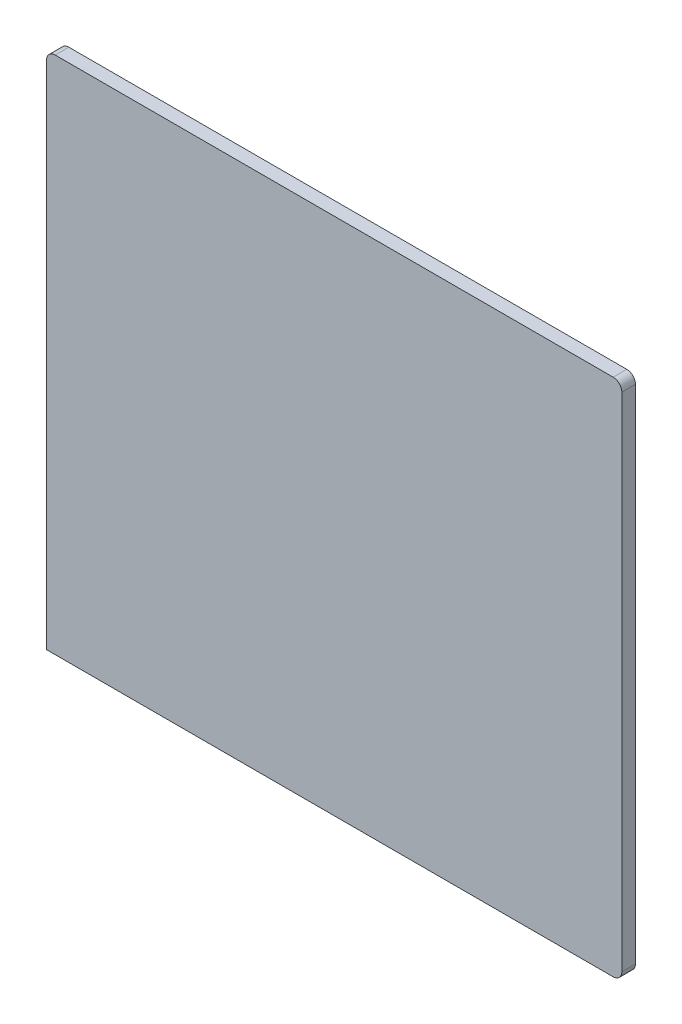
from build123d import *

# Parameters (mm, degrees)
BOSS_EXTRUDE1_DEPTH = 1.5748


with BuildPart() as part:
    # BPR2 PCB Outline → Boss-Extrude1 (new body)
    with BuildSketch(Plane.XY):
        with BuildLine():
            Line((114.542984325, 7.120432961), (102.642984325, 7.120432961))
            Line((102.642984325, 7.120432961), (82.642984325, 7.120432961))
            Line((82.642984325, 7.120432961), (49.072984325, 7.120432961))
            Line((49.072984325, 7.120432961), (49.072984325, 66.120432961))
            ThreePointArc((49.072984325, 66.120432961), (49.365877543, 66.827539743), (50.072984325, 67.120432961))
            Line((50.072984325, 67.120432961), (114.542984325, 67.120432961))
            ThreePointArc((114.542984325, 67.120432961), (115.250091106, 66.827539743), (115.542984325, 66.120432961))
            Line((115.542984325, 66.120432961), (115.542984325, 8.120432961))
            ThreePointArc((115.542984325, 8.120432961), (115.250091106, 7.41332618), (114.542984325, 7.120432961))
        make_face()
    extrude(amount=-BOSS_EXTRUDE1_DEPTH)


solid = part.part
